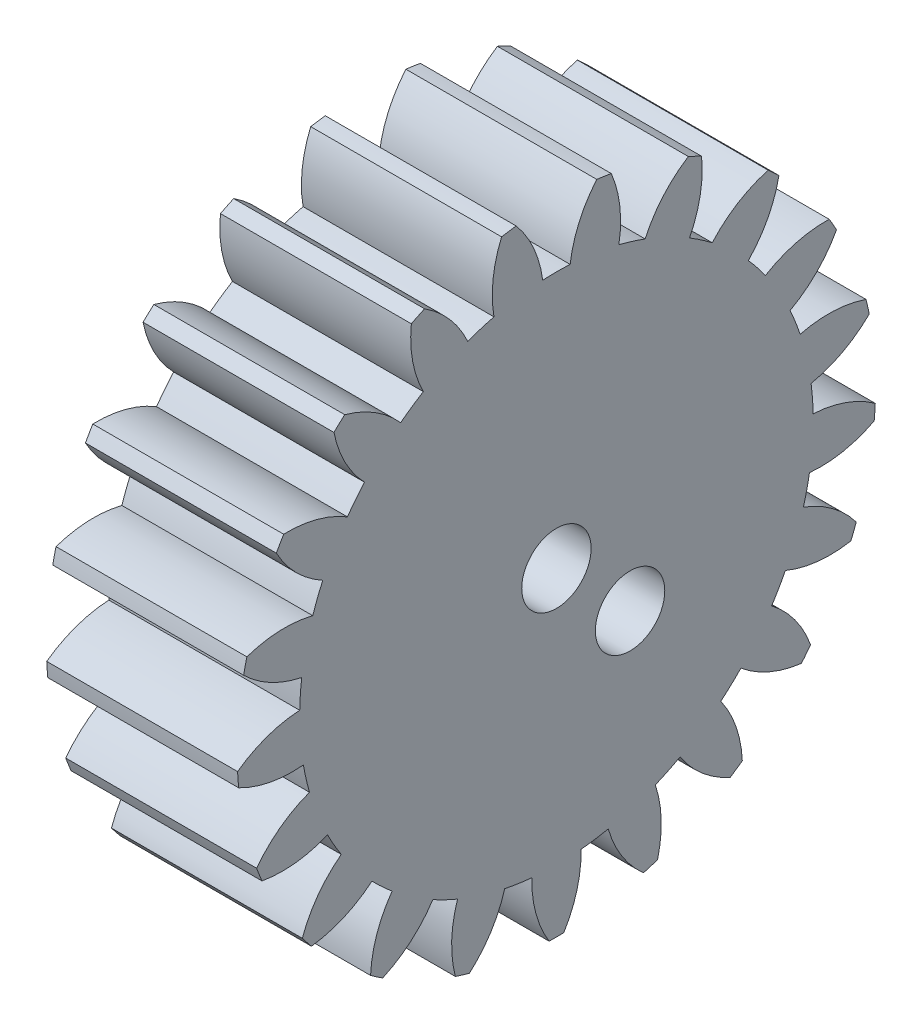
from build123d import *

# Parameters (mm, degrees)
BASPROSKE_W        = 5.5
BASPROSKE_H        = 9.2
TOOTHCUT_DEPTH     = 15.12550884
TEETHCUTS_COUNT    = 21
TEETHCUTS_ANGLE    = 342.857142857
BORSKE_R           = 1
BORE_DEPTH         = 50.0000508
SKETCH1_R          = 1
CUT_EXTRUDE1_DEPTH = 5.5


with BuildPart() as part:
    # BasProSke → Base-Revolve (revolve)
    with BuildSketch(Plane(origin=(0, 0, 0), x_dir=(1, 0, 0), z_dir=(0, 1, 0)), mode=Mode.PRIVATE) as base_revolve_sk:
        with Locations((2.75, 4.6)):
            Rectangle(BASPROSKE_W, BASPROSKE_H)
    revolve(base_revolve_sk.sketch.rotate(Axis((-10, 0, 0), (1, 0, 0)), 180), axis=Axis((-10, 0, 0), (1, 0, 0)))

    # TooCutSke → ToothCut (cut, through all)
    with BuildSketch(Plane(origin=(0, 0, 0), x_dir=(0, 0, -1), z_dir=(1, 0, 0))):
        with BuildLine():
            ThreePointArc((0.39557227, 7.388418205), (0, 7.399), (-0.39557227, 7.388418205))
            ThreePointArc((-0.39557227, 7.388418205), (-0.659317872, 8.326513344), (-1.181161837, 9.149473311))
            ThreePointArc((-1.181161837, 9.149473311), (0, 9.2254), (1.181161837, 9.149473311))
            ThreePointArc((1.181161837, 9.149473311), (0.659317872, 8.326513344), (0.39557227, 7.388418205))
        make_face()
    toothcut = extrude(amount=TOOTHCUT_DEPTH, mode=Mode.SUBTRACT)

    # TeethCuts: ToothCut ×21 about axis
    teethcuts_axis = Axis((-10, 0, 0), (1, 0, 0))
    for i in range(1, TEETHCUTS_COUNT):
        add(toothcut.rotate(teethcuts_axis, i * TEETHCUTS_ANGLE / (TEETHCUTS_COUNT - 1)), mode=Mode.SUBTRACT)

    # BorSke → Bore (cut, symmetric)
    with BuildSketch(Plane(origin=(0, 0, 0), x_dir=(0, 0, -1), z_dir=(1, 0, 0))):
        with Locations(Location((0, 0, 0), (0, 0, 180))):
            Circle(BORSKE_R)
    extrude(amount=BORE_DEPTH, both=True, mode=Mode.SUBTRACT)

    # Sketch1 → Cut-Extrude1 (cut)
    with BuildSketch(Plane(origin=(5.5, 0, 0), x_dir=(0, 0, -1), z_dir=(1, 0, 0))):
        with Locations((2.121320344, -2.121320344)):
            Circle(SKETCH1_R)
    extrude(amount=-CUT_EXTRUDE1_DEPTH, mode=Mode.SUBTRACT)


solid = part.part
